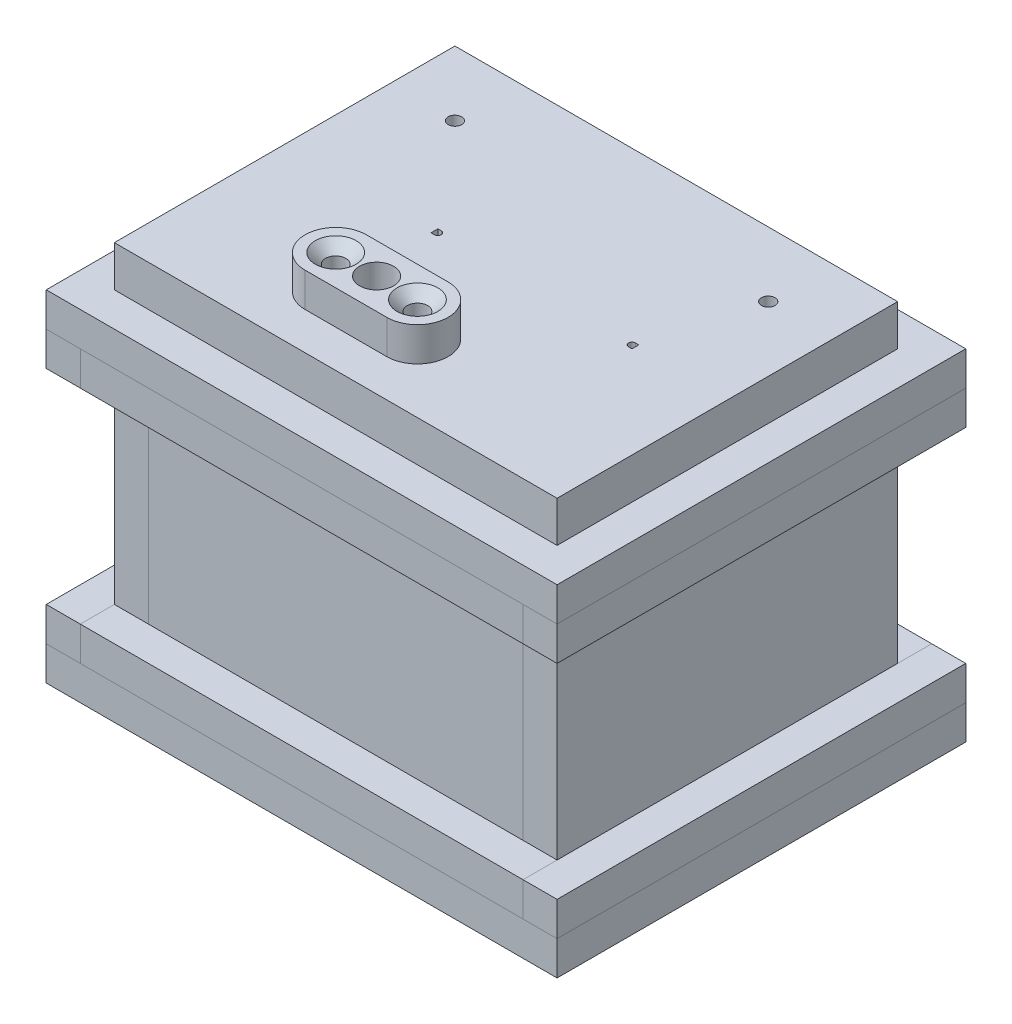
from build123d import *

# Parameters (mm, degrees)
SKETCH1_W              = 65
SKETCH1_H              = 50
BOSS_EXTRUDE1_DEPTH    = 5
SKETCH2_W              = 5
SKETCH2_H              = 50
BOSS_EXTRUDE24_DEPTH   = 40
BOSS_EXTRUDE24_2_DEPTH = 40
SKETCH2_6_W            = 55
SKETCH2_6_H            = 5
BOSS_EXTRUDE25_DEPTH   = 40
BOSS_EXTRUDE25_2_DEPTH = 40
SKETCH3_W              = 65
SKETCH3_H              = 50
BOSS_EXTRUDE4_DEPTH    = 5
SKETCH18_W             = 50
SKETCH18_H             = 35
CUT_EXTRUDE3_DEPTH     = 80.3473377
SKETCH17_W             = 65
SKETCH17_H             = 50
BOSS_EXTRUDE8_DEPTH    = 6
SKETCH6_W              = 18.5
SKETCH6_H              = 34.25
BOSS_EXTRUDE6_DEPTH    = 5
SKETCH7_W              = 18.5
SKETCH7_H              = 34.25
BOSS_EXTRUDE7_DEPTH    = 5
SKETCH19_R             = 1
SKETCH19_R_2           = 2.5
CUT_EXTRUDE4_DEPTH     = 30.25
SKETCH31_R             = 2.5
SKETCH31_R_2           = 1.5
BOSS_EXTRUDE18_DEPTH   = 5
CHAMFER1_SIZE          = 2
CHAMFER2_SIZE          = 1.5
SKETCH42_W             = 75
SKETCH42_H             = 60
SKETCH42_W_2           = 65
SKETCH42_H_2           = 50
BOSS_EXTRUDE22_DEPTH   = 5
SKETCH41_4_W           = 75
SKETCH41_4_H           = 60
BOSS_EXTRUDE23_DEPTH   = 5
BOSS_EXTRUDE20_DEPTH   = 5
BOSS_EXTRUDE20_2_DEPTH = 5
SKETCH41_3_W           = 65
SKETCH41_3_H           = 5
BOSS_EXTRUDE21_DEPTH   = 5
BOSS_EXTRUDE21_2_DEPTH = 5


with BuildPart() as part:
    # Sketch1 → Boss-Extrude1 (new body)
    with BuildSketch(Plane(origin=(0, 0, 0), x_dir=(1, 0, 0), z_dir=(0, 1, 0))):
        with Locations((-3.5, 25)):
            Rectangle(SKETCH1_W, SKETCH1_H)
    extrude(amount=BOSS_EXTRUDE1_DEPTH)

    # Sketch41<4> → Boss-Extrude23 (add)
    with BuildSketch(Plane(origin=(0, 5, 0), x_dir=(1, 0, 0), z_dir=(0, 1, 0))):
        with Locations((-3.5, 25)):
            Rectangle(SKETCH41_4_W, SKETCH41_4_H)
    extrude(amount=-BOSS_EXTRUDE23_DEPTH)


with BuildPart() as body_2:
    # Sketch2 → Boss-Extrude24 (new body)
    with BuildSketch(Plane(origin=(0, 5, 0), x_dir=(1, 0, 0), z_dir=(0, 1, 0))):
        with Locations((-33.5, 25)):
            Rectangle(SKETCH2_W, SKETCH2_H)
    extrude(amount=BOSS_EXTRUDE24_DEPTH)


with BuildPart() as body_3:
    # Sketch2 → Boss-Extrude24 2 (new body)
    with BuildSketch(Plane(origin=(0, 5, 0), x_dir=(1, 0, 0), z_dir=(0, 1, 0))):
        with Locations((26.5, 25)):
            Rectangle(SKETCH2_W, SKETCH2_H)
    extrude(amount=BOSS_EXTRUDE24_2_DEPTH)


with BuildPart() as body_4:
    # Sketch2<6> → Boss-Extrude25 (new body)
    with BuildSketch(Plane(origin=(0, 5, 0), x_dir=(1, 0, 0), z_dir=(0, 1, 0))):
        with Locations((-3.5, 47.5)):
            Rectangle(SKETCH2_6_W, SKETCH2_6_H)
    extrude(amount=BOSS_EXTRUDE25_DEPTH)


with BuildPart() as body_5:
    # Sketch2<6> → Boss-Extrude25 2 (new body)
    with BuildSketch(Plane(origin=(0, 5, 0), x_dir=(1, 0, 0), z_dir=(0, 1, 0))):
        with Locations((-3.5, 2.5)):
            Rectangle(SKETCH2_6_W, SKETCH2_6_H)
    extrude(amount=BOSS_EXTRUDE25_2_DEPTH)


with BuildPart() as body_6:
    # Sketch3 → Boss-Extrude4 (new body)
    with BuildSketch(Plane(origin=(0, 45, 0), x_dir=(1, 0, 0), z_dir=(0, 1, 0))):
        with Locations((-3.5, 25)):
            Rectangle(SKETCH3_W, SKETCH3_H)
    extrude(amount=BOSS_EXTRUDE4_DEPTH)

    # Sketch18 → Cut-Extrude3 (cut, through all)
    with BuildSketch(Plane(origin=(0, 50, 0), x_dir=(1, 0, 0), z_dir=(0, 1, 0))):
        with Locations((-3.5, 25)):
            Rectangle(SKETCH18_W, SKETCH18_H)
    extrude(amount=-CUT_EXTRUDE3_DEPTH, mode=Mode.SUBTRACT)

    # Sketch42 → Boss-Extrude22 (add)
    with BuildSketch(Plane(origin=(0, 50, 0), x_dir=(1, 0, 0), z_dir=(0, 1, 0))):
        with Locations((-3.5, 25)):
            Rectangle(SKETCH42_W, SKETCH42_H)
        with Locations((-3.5, 25)):
            Rectangle(SKETCH42_W_2, SKETCH42_H_2, mode=Mode.SUBTRACT)
    extrude(amount=-BOSS_EXTRUDE22_DEPTH)


with BuildPart() as body_7:
    # Sketch17 → Boss-Extrude8 (new body)
    with BuildSketch(Plane(origin=(0, 50, 0), x_dir=(1, 0, 0), z_dir=(0, 1, 0))):
        with Locations((-3.5, 25)):
            Rectangle(SKETCH17_W, SKETCH17_H)
    extrude(amount=BOSS_EXTRUDE8_DEPTH)


with BuildPart() as body_8:
    # Sketch6 → Boss-Extrude6 (new body)
    with BuildSketch(Plane(origin=(-14, 0, 0), x_dir=(0, 0, -1), z_dir=(1, 0, 0))):
        with Locations((25, 32.875)):
            Rectangle(SKETCH6_W, SKETCH6_H)
    extrude(amount=BOSS_EXTRUDE6_DEPTH)


with BuildPart() as body_9:
    # Sketch7 → Boss-Extrude7 (new body)
    with BuildSketch(Plane(origin=(10.5, 0, 0), x_dir=(0, 0, -1), z_dir=(1, 0, 0))):
        with Locations((25, 32.875)):
            Rectangle(SKETCH7_W, SKETCH7_H)
    extrude(amount=BOSS_EXTRUDE7_DEPTH)


with BuildPart() as cut_extrude4_tool:
    # Sketch19 → Cut-Extrude4 (new body)
    with BuildSketch(Plane(origin=(0, 56, 0), x_dir=(1, 0, 0), z_dir=(0, 1, 0))):
        with Locations(Location((-26.5, 40.5, 0), (0, 0, 270))):
            Circle(SKETCH19_R)
        with BuildLine():
            Line((-14, 24.5), (-13.5, 24.5))
            ThreePointArc((-13.5, 24.5), (-13, 25), (-13.5, 25.5))
            Line((-13.5, 25.5), (-14, 25.5))
            Line((-14, 25.5), (-14, 24.5))
        make_face()
        with Locations(Location((-7.5, 10, 0), (0, 0, 270))):
            Circle(SKETCH19_R_2)
        with Locations(Location((19.5, 40.5, 0), (0, 0, 270))):
            Circle(SKETCH19_R)
        with BuildLine():
            ThreePointArc((15, 24.5), (14.5, 25), (15, 25.5))
            Line((15, 25.5), (15.5, 25.5))
            Line((15.5, 25.5), (15.5, 24.5))
            Line((15.5, 24.5), (15, 24.5))
        make_face()
    extrude(amount=-CUT_EXTRUDE4_DEPTH)


with BuildPart() as body_7_1:
    add(body_7.part)

    # Cut-Extrude4: cut by cut_extrude4_tool
    add(cut_extrude4_tool.part, mode=Mode.SUBTRACT)

    # Chamfer1
    chamfer1_edges = [body_7_1.edges().sort_by_distance(p)[0] for p in [
        (-7.5, 56, -12.5),
    ]]
    chamfer(chamfer1_edges, length=CHAMFER1_SIZE)


with BuildPart() as body_8_1:
    add(body_8.part)

    # Cut-Extrude4: cut by cut_extrude4_tool
    add(cut_extrude4_tool.part, mode=Mode.SUBTRACT)


with BuildPart() as body_9_1:
    add(body_9.part)

    # Cut-Extrude4: cut by cut_extrude4_tool
    add(cut_extrude4_tool.part, mode=Mode.SUBTRACT)


with BuildPart() as body_10:
    # Sketch31 → Boss-Extrude18 (new body)
    with BuildSketch(Plane(origin=(0, 56, 0), x_dir=(1, 0, 0), z_dir=(0, 1, 0))):
        with BuildLine():
            Line((-1.5, 5.5), (-13.5, 5.5))
            ThreePointArc((-13.5, 5.5), (-18, 10), (-13.5, 14.5))
            Line((-13.5, 14.5), (-1.5, 14.5))
            ThreePointArc((-1.5, 14.5), (3, 10), (-1.5, 5.5))
        make_face()
        with Locations(Location((-7.5, 10, 0), (0, 0, 270))):
            Circle(SKETCH31_R, mode=Mode.SUBTRACT)
        with Locations(Location((-13.5, 10, 0), (0, 0, 270))):
            Circle(SKETCH31_R_2, mode=Mode.SUBTRACT)
        with Locations(Location((-1.5, 10, 0), (0, 0, 90))):
            Circle(SKETCH31_R_2, mode=Mode.SUBTRACT)
    extrude(amount=BOSS_EXTRUDE18_DEPTH)

    # Chamfer2
    chamfer2_edges = [body_10.edges().sort_by_distance(p)[0] for p in [
        (-13.5, 61, -11.5),
        (-1.5, 61, -8.5),
    ]]
    chamfer(chamfer2_edges, length=CHAMFER2_SIZE)


with BuildPart() as body_11:
    # Sketch41 → Boss-Extrude20 (new body)
    with BuildSketch(Plane(origin=(0, 5, 0), x_dir=(1, 0, 0), z_dir=(0, 1, 0))):
        Polygon((-36, -5), (-36, 0), (-36, 50), (-36, 55), (-41, 55), (-41, -5), align=None)
    extrude(amount=BOSS_EXTRUDE20_DEPTH)


with BuildPart() as body_12:
    # Sketch41 → Boss-Extrude20 2 (new body)
    with BuildSketch(Plane(origin=(0, 5, 0), x_dir=(1, 0, 0), z_dir=(0, 1, 0))):
        Polygon((29, 50), (29, 0), (29, -5), (34, -5), (34, 55), (29, 55), align=None)
    extrude(amount=BOSS_EXTRUDE20_2_DEPTH)


with BuildPart() as body_13:
    # Sketch41<3> → Boss-Extrude21 (new body)
    with BuildSketch(Plane(origin=(0, 5, 0), x_dir=(1, 0, 0), z_dir=(0, 1, 0))):
        with Locations((-3.5, 52.5)):
            Rectangle(SKETCH41_3_W, SKETCH41_3_H)
    extrude(amount=BOSS_EXTRUDE21_DEPTH)


with BuildPart() as body_14:
    # Sketch41<3> → Boss-Extrude21 2 (new body)
    with BuildSketch(Plane(origin=(0, 5, 0), x_dir=(1, 0, 0), z_dir=(0, 1, 0))):
        with Locations((-3.5, -2.5)):
            Rectangle(SKETCH41_3_W, SKETCH41_3_H)
    extrude(amount=BOSS_EXTRUDE21_2_DEPTH)


with BuildPart() as body_15:
    # Mirror1: mirrored copy
    add(body_13.part.mirror(Plane(origin=(0, 25, 0), x_dir=(0, 0, 1), z_dir=(0, -1, 0))))


with BuildPart() as body_16:
    # Mirror1 2: mirrored copy
    add(body_12.part.mirror(Plane(origin=(0, 25, 0), x_dir=(0, 0, 1), z_dir=(0, -1, 0))))


with BuildPart() as body_17:
    # Mirror1 3: mirrored copy
    add(body_11.part.mirror(Plane(origin=(0, 25, 0), x_dir=(0, 0, 1), z_dir=(0, -1, 0))))


with BuildPart() as body_18:
    # Mirror1 4: mirrored copy
    add(body_14.part.mirror(Plane(origin=(0, 25, 0), x_dir=(0, 0, 1), z_dir=(0, -1, 0))))


solid = Compound([part.part, body_2.part, body_3.part, body_4.part, body_5.part, body_6.part, body_7_1.part, body_8_1.part, body_9_1.part, body_10.part, body_11.part, body_12.part, body_13.part, body_14.part, body_15.part, body_16.part, body_17.part, body_18.part])
